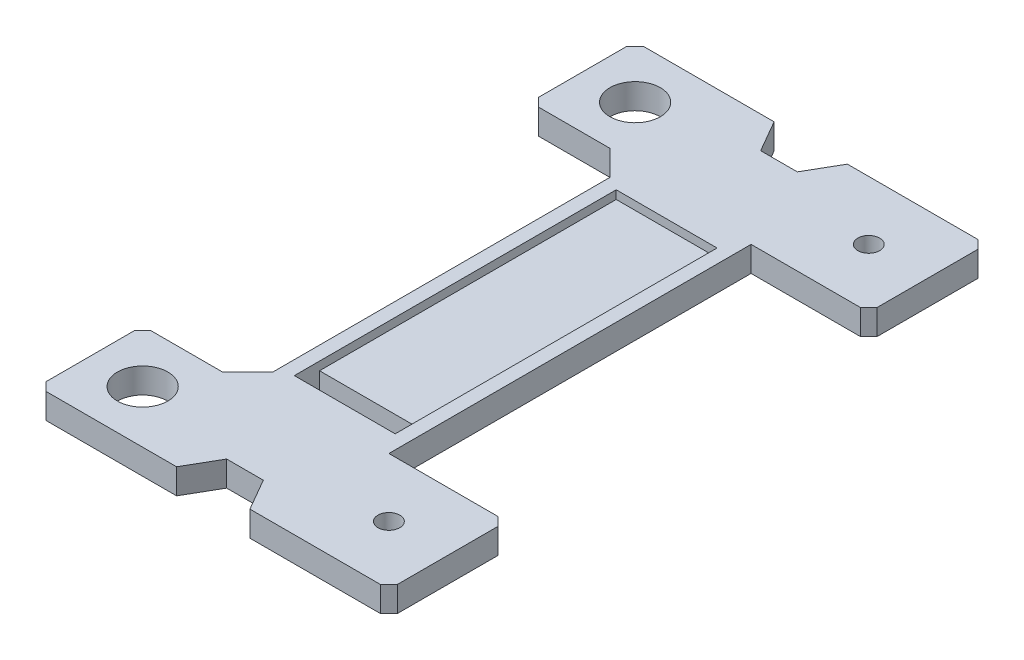
from build123d import *

# Parameters (mm, degrees)
BOSS_EXTRUDE1_DEPTH = 3
SKETCH2_R           = 3
SKETCH2_R_2         = 1.3
CUT_EXTRUDE1_DEPTH  = 47.16592358
SKETCH3_W           = 12
SKETCH3_H           = 38.3
CUT_EXTRUDE2_DEPTH  = 1
SKETCH4_W           = 12
SKETCH4_H           = 3
CUT_EXTRUDE3_DEPTH  = 47.111739286
CHAMFER1_SIZE       = 3
CUT_EXTRUDE4_DEPTH  = 47.16592358
CHAMFER2_SIZE       = 1


with BuildPart() as part:
    # Sketch1 → Boss-Extrude1 (new body)
    with BuildSketch(Plane(origin=(0, 0, 0), x_dir=(1, 0, 0), z_dir=(0, 1, 0))):
        Polygon((0, 23.05), (0, -23.05), (-12.5, -23.05), (-12.5, -35.55), (29.3, -35.55), (29.3, -21.55), (15.3, -21.55), (15.3, 21.55), (29.3, 21.55), (29.3, 35.55), (-12.5, 35.55), (-12.5, 23.05), align=None)
    extrude(amount=BOSS_EXTRUDE1_DEPTH)

    # Sketch2 → Cut-Extrude1 (cut, through all)
    with BuildSketch(Plane(origin=(0, 3, 0), x_dir=(1, 0, 0), z_dir=(0, 1, 0))):
        with Locations(Location((-6.25, 29.3, 0), (0, 0, 270))):
            Circle(SKETCH2_R)
        with Locations(Location((-6.25, -29.3, 0), (0, 0, 270))):
            Circle(SKETCH2_R)
        with Locations(Location((22.3, -28.55, 0), (0, 0, 270))):
            Circle(SKETCH2_R_2)
        with Locations(Location((22.3, 28.55, 0), (0, 0, 270))):
            Circle(SKETCH2_R_2)
    extrude(amount=-CUT_EXTRUDE1_DEPTH, mode=Mode.SUBTRACT)

    # Sketch3 → Cut-Extrude2 (cut)
    with BuildSketch(Plane(origin=(0, 3, 0), x_dir=(1, 0, 0), z_dir=(0, 1, 0))):
        with Locations((7.65, 0)):
            Rectangle(SKETCH3_W, SKETCH3_H)
    extrude(amount=-CUT_EXTRUDE2_DEPTH, mode=Mode.SUBTRACT)

    # Sketch4 → Cut-Extrude3 (cut, through all)
    with BuildSketch(Plane(origin=(0, 2, 0), x_dir=(1, 0, 0), z_dir=(0, 1, 0))):
        with Locations((7.65, -17.65)):
            Rectangle(SKETCH4_W, SKETCH4_H)
    extrude(amount=-CUT_EXTRUDE3_DEPTH, mode=Mode.SUBTRACT)

    # Chamfer1
    chamfer1_edges = [part.edges().sort_by_distance(p)[0] for p in [
        (0, 1.5, 23.05),
        (0, 1.5, -23.05),
    ]]
    chamfer(chamfer1_edges, length=CHAMFER1_SIZE)

    # Sketch5 → Cut-Extrude4 (cut, through all)
    with BuildSketch(Plane(origin=(0, 3, 0), x_dir=(1, 0, 0), z_dir=(0, 1, 0))):
        Polygon((4.037233657, -35.55), (6.218616828, -39.328266484), (10.581383172, -39.328266484), (12.762766343, -35.55), (10.581383172, -31.771733516), (6.218616828, -31.771733516), align=None)
        Polygon((4.037233657, 35.55), (6.218616828, 31.771733516), (10.581383172, 31.771733516), (12.762766343, 35.55), (10.581383172, 39.328266484), (6.218616828, 39.328266484), align=None)
    extrude(amount=-CUT_EXTRUDE4_DEPTH, mode=Mode.SUBTRACT)

    # Chamfer2
    chamfer2_edges = [part.edges().sort_by_distance(p)[0] for p in [
        (-12.5, 1.5, -23.05),
        (-12.5, 1.5, -35.55),
        (29.3, 1.5, -35.55),
        (29.3, 1.5, -21.55),
        (29.3, 1.5, 21.55),
        (29.3, 1.5, 35.55),
        (-12.5, 1.5, 35.55),
        (-12.5, 1.5, 23.05),
    ]]
    chamfer(chamfer2_edges, length=CHAMFER2_SIZE)


solid = part.part
